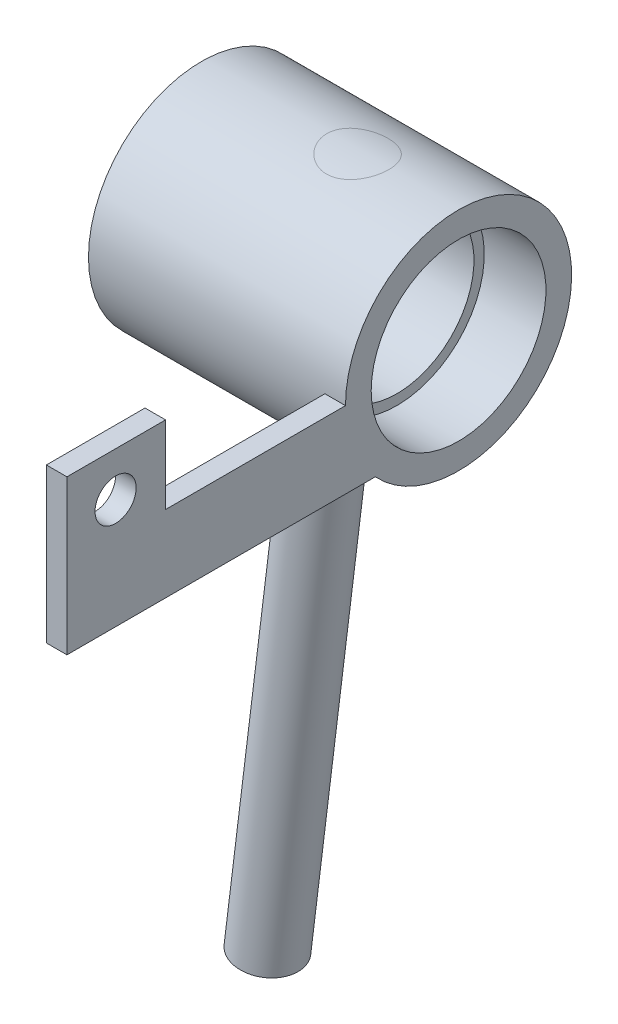
from build123d import *

# Parameters (mm, degrees)
BOSS_EXTRUDE1_START      = -4
SKETCH8_R                = 4
BOSS_EXTRUDE1_DEPTH      = 4
BOSS_EXTRUDE2_DEPTH      = 7
BOSS_EXTRUDE2_DEPTH_BACK = 100
SKETCH7_2_R              = 6


with BuildPart() as part:
    # Sketch1 → Revolve1 (revolve)
    with BuildSketch(Plane.XY):
        Polygon((-25, 22), (-25, 17), (-13, 17), (-13, 15), (13, 15), (13, 17), (25, 17), (25, 22), align=None)
    revolve(axis=Axis((-45.766103365, 0, 0), (1, 0, 0)))

    # Sketch8 → Boss-Extrude1 (add)
    with BuildSketch(Plane(origin=(25, 0, 0), x_dir=(0, 0, -1), z_dir=(1, 0, 0)).offset(BOSS_EXTRUDE1_START)):
        with BuildLine():
            Line((-22, 0), (-57, 0))
            Line((-57, 0), (-57, 15.102123796))
            Line((-57, 15.102123796), (-76.188059939, 15.102123796))
            Line((-76.188059939, 15.102123796), (-76.188059939, -14.897876204))
            Line((-76.188059939, -14.897876204), (-16.188059939, -14.897876204))
            ThreePointArc((-16.188059939, -14.897876204), (-20.49557658, -7.99570764), (-22, 0))
        make_face()
        with Locations((-66.724926484, 6.517856695)):
            Circle(SKETCH8_R, mode=Mode.SUBTRACT)
    extrude(amount=BOSS_EXTRUDE1_DEPTH)

    # Sketch7<2> → Boss-Extrude2 (add, two sides: drawn at the far end of the back side and taken through both)
    with BuildSketch(Plane(origin=(-2.661140852, -21.673252989, 0), x_dir=(0, 0, -1), z_dir=(0.1218693434051474, 0.9925461516413221, 0)).offset(-BOSS_EXTRUDE2_DEPTH_BACK)):
        with Locations((0, -2.681125555)):
            Circle(SKETCH7_2_R)
    extrude(amount=BOSS_EXTRUDE2_DEPTH + BOSS_EXTRUDE2_DEPTH_BACK)


solid = part.part
